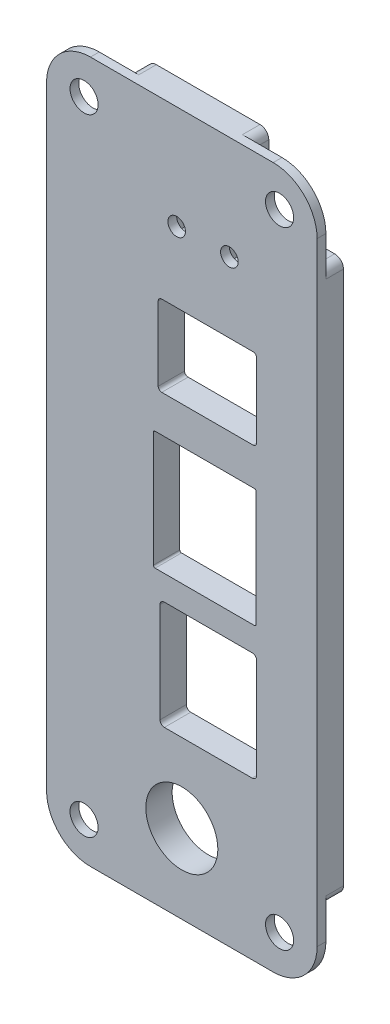
from build123d import *

# Parameters (mm, degrees)
SKETCH_1_R          = 1
EXTRUDE_1_DEPTH     = 3
SKETCH_2_W          = 11
SKETCH_2_H          = 38
CUT_EXTRUDE_1_DEPTH = 1
CUT_EXTRUDE_START   = -2
CUT_EXTRUDE_2_DEPTH = 2
SKETCH_4_R          = 1.6
CUT_EXTRUDE_3_DEPTH = 62.990079852
SKETCH_6_W          = 2.6
SKETCH_6_H          = 3.5
SKETCH_6_W_2        = 2.5
CUT_EXTRUDE_4_DEPTH = 2
SKETCH_7_R          = 4.1
CUT_EXTRUDE_5_DEPTH = 63.030395775
FILLET_1_R          = 1


with BuildPart() as part:
    # 草图1 → 凸台-拉伸1 (new body)
    with BuildSketch(Plane.XY):
        with BuildLine():
            Line((47.4, -34.9), (47.4, 34.9))
            ThreePointArc((47.4, 34.9), (45.935533906, 38.435533906), (42.4, 39.9))
            Line((42.4, 39.9), (21.6, 39.9))
            ThreePointArc((21.6, 39.9), (18.064466094, 38.435533906), (16.6, 34.9))
            Line((16.6, 34.9), (16.6, -34.9))
            ThreePointArc((16.6, -34.9), (18.064466094, -38.435533906), (21.6, -39.9))
            Line((21.6, -39.9), (42.4, -39.9))
            ThreePointArc((42.4, -39.9), (45.935533906, -38.435533906), (47.4, -34.9))
        make_face()
        with Locations((37.413843028, 28.102429875)):
            Circle(SKETCH_1_R, mode=Mode.SUBTRACT)
        with Locations((31.413843028, 28.102429875)):
            Circle(SKETCH_1_R, mode=Mode.SUBTRACT)
        with BuildLine():
            Line((40.513850359, -21.477641558), (40.513850359, -10.127641653))
            ThreePointArc((40.513850359, -10.127641653), (40.367403749, -9.774088262), (40.013850359, -9.627641653))
            Line((40.013850359, -9.627641653), (30.013850359, -9.627641653))
            ThreePointArc((30.013850359, -9.627641653), (29.660296968, -9.774088262), (29.513850359, -10.127641653))
            Line((29.513850359, -10.127641653), (29.513850359, -21.477641558))
            ThreePointArc((29.513850359, -21.477641558), (29.660296968, -21.831194949), (30.013850359, -21.977641558))
            Line((30.013850359, -21.977641558), (40.013850359, -21.977641558))
            ThreePointArc((40.013850359, -21.977641558), (40.367403749, -21.831194949), (40.513850359, -21.477641558))
        make_face(mode=Mode.SUBTRACT)
        with BuildLine():
            Line((40.464996896, 6.495389649), (40.464996896, -6.604609867))
            ThreePointArc((40.464996896, -6.604609867), (40.406418252, -6.746031223), (40.264996896, -6.804609867))
            Line((40.264996896, -6.804609867), (28.963873947, -6.804609867))
            ThreePointArc((28.963873947, -6.804609867), (28.822452591, -6.746031223), (28.763873947, -6.604609867))
            Line((28.763873947, -6.604609867), (28.763873947, 6.495389649))
            ThreePointArc((28.763873947, 6.495389649), (28.822452591, 6.636811005), (28.963873947, 6.695389649))
            Line((28.963873947, 6.695389649), (40.264996896, 6.695389649))
            ThreePointArc((40.264996896, 6.695389649), (40.406418252, 6.636811005), (40.464996896, 6.495389649))
        make_face(mode=Mode.SUBTRACT)
        with BuildLine():
            Line((40.513843009, 11.302412116), (40.513843009, 19.702429875))
            ThreePointArc((40.513843009, 19.702429875), (40.396685721, 19.985272588), (40.113843009, 20.102429875))
            Line((40.113843009, 20.102429875), (29.713821303, 20.102429875))
            ThreePointArc((29.713821303, 20.102429875), (29.43097859, 19.985272588), (29.313821303, 19.702429875))
            Line((29.313821303, 19.702429875), (29.313821303, 11.302412116))
            ThreePointArc((29.313821303, 11.302412116), (29.43097859, 11.019569403), (29.713821303, 10.902412116))
            Line((29.713821303, 10.902412116), (40.113843009, 10.902412116))
            ThreePointArc((40.113843009, 10.902412116), (40.396685721, 11.019569403), (40.513843009, 11.302412116))
        make_face(mode=Mode.SUBTRACT)
    extrude(amount=-EXTRUDE_1_DEPTH)

    # 草图2 → 切除-拉伸1 (cut)
    with BuildSketch(Plane(origin=(0, 0, -3), x_dir=(-1, 0, 0), z_dir=(0, 0, -1))):
        with Locations((-22.1, 0)):
            Rectangle(SKETCH_2_W, SKETCH_2_H)
    extrude(amount=-CUT_EXTRUDE_1_DEPTH, mode=Mode.SUBTRACT)

    # 草图3 → 切除-拉伸2 (cut)
    with BuildSketch(Plane(origin=(0, 0, -3), x_dir=(-1, 0, 0), z_dir=(0, 0, -1)).offset(CUT_EXTRUDE_START)):
        with BuildLine():
            Line((-47.4, -31.4), (-38.9, -31.4))
            Line((-38.9, -31.4), (-38.9, -39.9))
            Line((-38.9, -39.9), (-42.4, -39.9))
            ThreePointArc((-42.4, -39.9), (-45.935533906, -38.435533906), (-47.4, -34.9))
            Line((-47.4, -34.9), (-47.4, -31.4))
        make_face()
        with BuildLine():
            Line((-47.4, 34.9), (-47.4, 31.4))
            Line((-47.4, 31.4), (-38.9, 31.4))
            Line((-38.9, 31.4), (-38.9, 39.9))
            Line((-38.9, 39.9), (-42.4, 39.9))
            ThreePointArc((-42.4, 39.9), (-45.935533906, 38.435533906), (-47.4, 34.9))
        make_face()
        with BuildLine():
            Line((-16.6, 31.4), (-25.1, 31.4))
            Line((-25.1, 31.4), (-25.1, 39.9))
            Line((-25.1, 39.9), (-21.6, 39.9))
            ThreePointArc((-21.6, 39.9), (-18.064466094, 38.435533906), (-16.6, 34.9))
            Line((-16.6, 34.9), (-16.6, 31.4))
        make_face()
        with BuildLine():
            Line((-16.6, -34.9), (-16.6, -31.4))
            Line((-16.6, -31.4), (-25.1, -31.4))
            Line((-25.1, -31.4), (-25.1, -39.9))
            Line((-25.1, -39.9), (-21.6, -39.9))
            ThreePointArc((-21.6, -39.9), (-18.064466094, -38.435533906), (-16.6, -34.9))
        make_face()
    extrude(amount=CUT_EXTRUDE_2_DEPTH, mode=Mode.SUBTRACT)

    # 草图4 → 切除-拉伸3 (cut, through all)
    with BuildSketch(Plane(origin=(0, 0, -1), x_dir=(-1, 0, 0), z_dir=(0, 0, -1))):
        with Locations((-20.872307757, 35.627692243)):
            Circle(SKETCH_4_R)
        with Locations(Location((-20.872307757, -35.627692243, 0), (0, 0, 180))):
            Circle(SKETCH_4_R)
        with Locations((-43.127692243, -35.627692243)):
            Circle(SKETCH_4_R)
        with Locations(Location((-43.127692243, 35.627692243, 0), (0, 0, 180))):
            Circle(SKETCH_4_R)
    extrude(amount=-CUT_EXTRUDE_3_DEPTH, mode=Mode.SUBTRACT)

    # 草图6 → 切除-拉伸4 (cut)
    with BuildSketch(Plane(origin=(0, 0, -3), x_dir=(-1, 0, 0), z_dir=(0, 0, -1))):
        with Locations((-37.413843028, 28.102429875)):
            Rectangle(SKETCH_6_W, SKETCH_6_H)
        with Locations((-31.413843028, 28.102429875)):
            Rectangle(SKETCH_6_W_2, SKETCH_6_H)
    extrude(amount=-CUT_EXTRUDE_4_DEPTH, mode=Mode.SUBTRACT)

    # 草图7 → 切除-拉伸5 (cut, through all)
    with BuildSketch(Plane.XY):
        with Locations((32, -30.938820779)):
            Circle(SKETCH_7_R)
    extrude(amount=-CUT_EXTRUDE_5_DEPTH, mode=Mode.SUBTRACT)

    # 圆角1
    fillet_1_edges = [part.edges().sort_by_distance(p)[0] for p in [
        (25.1, -39.9, -2),
        (16.6, -31.4, -2),
        (16.6, 31.4, -2),
        (25.1, 39.9, -2),
        (38.9, 39.9, -2),
        (47.4, 31.4, -2),
        (47.4, -31.4, -2),
        (38.9, -39.9, -2),
    ]]
    fillet(fillet_1_edges, radius=FILLET_1_R)


solid = part.part
